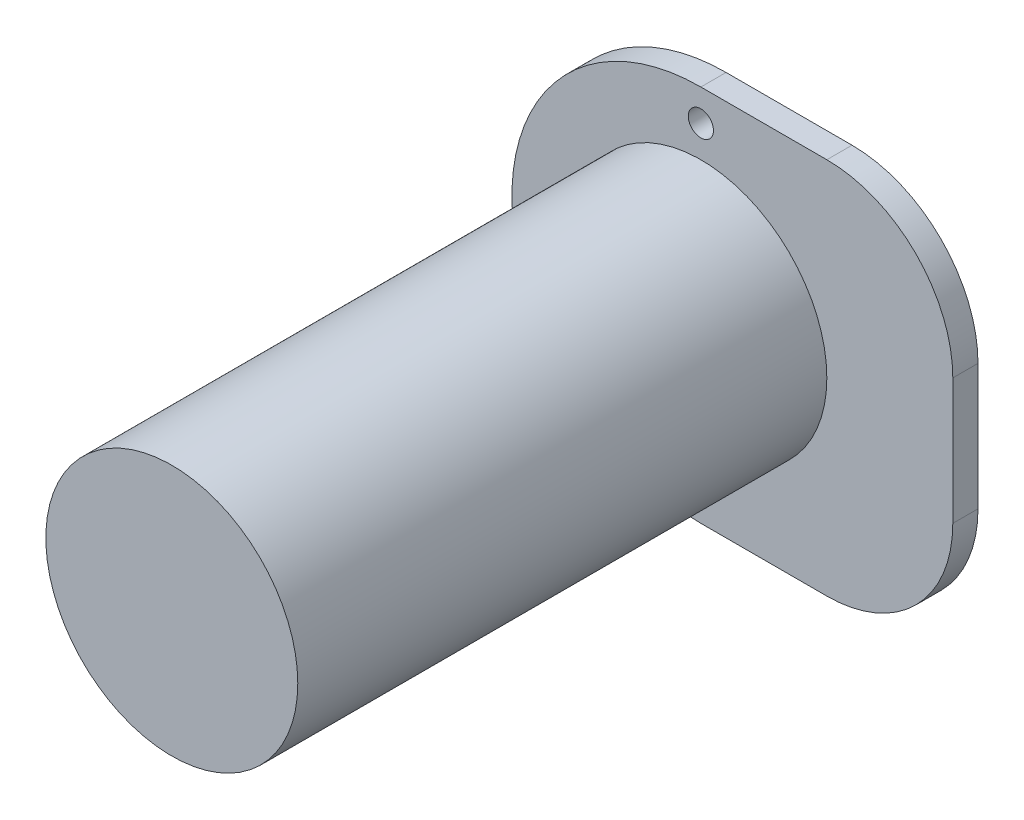
from build123d import *

# Parameters (mm, degrees)
SKETCH1_R           = 50
BOSS_EXTRUDE1_DEPTH = 210
BOSS_EXTRUDE2_DEPTH = 10
CUT_EXTRUDE1_REACH  = 255.032
SKETCH3_R           = 5
FILLET1_R           = 50


with BuildPart() as part:
    # Sketch1 → Boss-Extrude1 (new body)
    with BuildSketch(Plane.XY):
        Circle(SKETCH1_R)
    extrude(amount=BOSS_EXTRUDE1_DEPTH)

    # Sketch2 → Boss-Extrude2 (add)
    with BuildSketch(Plane(origin=(0, 0, 0), x_dir=(-1, 0, 0), z_dir=(0, 0, -1))):
        with BuildLine():
            Line((0, -75), (-100, -75))
            Line((-100, -75), (-100, 75))
            Line((-100, 75), (0, 75))
            ThreePointArc((0, 75), (75, 0), (0, -75))
        make_face()
    extrude(amount=BOSS_EXTRUDE2_DEPTH)

    # Sketch3 → Cut-Extrude1 (cut, up to next)
    with BuildSketch(Plane(origin=(0, 0, -10), x_dir=(-1, 0, 0), z_dir=(0, 0, -1)), mode=Mode.PRIVATE) as cut_extrude1_sk1:
        with Locations((0, 62.5)):
            Circle(SKETCH3_R)
    cut_extrude1_tool1 = extrude(cut_extrude1_sk1.sketch, amount=-CUT_EXTRUDE1_REACH, mode=Mode.PRIVATE) & part.part
    # Sketch3 → Cut-Extrude1 (cut, up to next)
    with BuildSketch(Plane(origin=(0, 0, -10), x_dir=(-1, 0, 0), z_dir=(0, 0, -1)), mode=Mode.PRIVATE) as cut_extrude1_sk2:
        with Locations((0, -62.5)):
            Circle(SKETCH3_R)
    cut_extrude1_tool2 = extrude(cut_extrude1_sk2.sketch, amount=-CUT_EXTRUDE1_REACH, mode=Mode.PRIVATE) & part.part
    # Sketch3 → Cut-Extrude1 (cut, up to next)
    with BuildSketch(Plane(origin=(0, 0, -10), x_dir=(-1, 0, 0), z_dir=(0, 0, -1)), mode=Mode.PRIVATE) as cut_extrude1_sk3:
        with Locations((62.5, 0)):
            Circle(SKETCH3_R)
    cut_extrude1_tool3 = extrude(cut_extrude1_sk3.sketch, amount=-CUT_EXTRUDE1_REACH, mode=Mode.PRIVATE) & part.part
    add(cut_extrude1_tool1.solids().sort_by_distance((0, 62.5, -10))[0], mode=Mode.SUBTRACT)
    add(cut_extrude1_tool2.solids().sort_by_distance((0, -62.5, -10))[0], mode=Mode.SUBTRACT)
    add(cut_extrude1_tool3.solids().sort_by_distance((-62.5, 0, -10))[0], mode=Mode.SUBTRACT)

    # Fillet1
    fillet1_edges = [part.edges().sort_by_distance(p)[0] for p in [
        (100, 75, -5),
        (100, -75, -5),
    ]]
    fillet(fillet1_edges, radius=FILLET1_R)


solid = part.part
